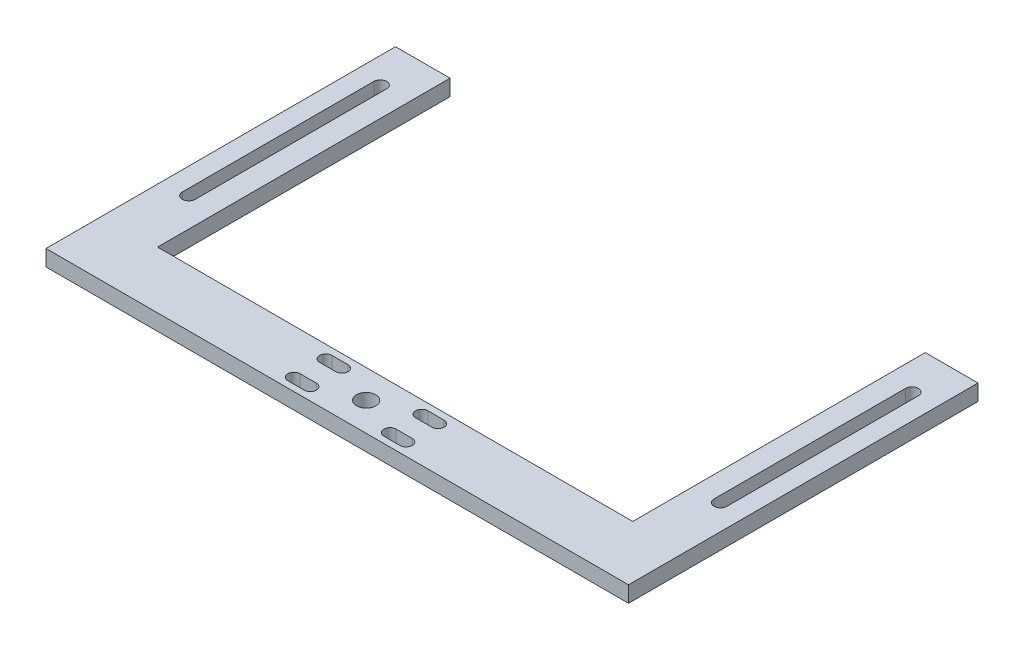
from build123d import *

# Parameters (mm, degrees)
SKETCH_5_R          = 3
EXTRUDE_4_DEPTH     = 5
CUT_EXTRUDE_2_DEPTH = 8.5
CUT_EXTRUDE_4_DEPTH = 8.5


with BuildPart() as part:
    # 草图5 → 凸台-拉伸4 (new body)
    with BuildSketch(Plane(origin=(0, 0, 0), x_dir=(1, 0, 0), z_dir=(0, 1, 0))):
        Polygon((-103.043555275, 72.404841583), (-103.043555275, -36.501510282), (78.477843527, -36.501510282), (78.477843527, 72.404841583), (62.047530944, 72.404841583), (62.047530944, -18.742135335), (-86.043555275, -18.742135335), (-86.043555275, 72.404841583), align=None)
        with BuildLine():
            Line((0.233182571, -20.809880528), (5.30281271, -20.809880528))
            ThreePointArc((5.30281271, -20.809880528), (7.20281271, -22.709880528), (5.30281271, -24.609880528))
            Line((5.30281271, -24.609880528), (0.233182571, -24.609880528))
            ThreePointArc((0.233182571, -24.609880528), (-1.666817429, -22.709880528), (0.233182571, -20.809880528))
        make_face(mode=Mode.SUBTRACT)
        with BuildLine():
            ThreePointArc((-29.666312365, -34.509375465), (-31.566312365, -32.609375465), (-29.666312365, -30.709375465))
            Line((-29.666312365, -30.709375465), (-24.596682227, -30.709375465))
            ThreePointArc((-24.596682227, -30.709375465), (-22.696682227, -32.609375465), (-24.596682227, -34.509375465))
            Line((-24.596682227, -34.509375465), (-29.666312365, -34.509375465))
        make_face(mode=Mode.SUBTRACT)
        with BuildLine():
            ThreePointArc((-29.666312365, -24.610941368), (-31.566842785, -22.710410948), (-29.666312365, -20.809880528))
            Line((-29.666312365, -20.809880528), (-24.596682227, -20.809880528))
            ThreePointArc((-24.596682227, -20.809880528), (-22.696151807, -22.710410948), (-24.596682227, -24.610941368))
            Line((-24.596682227, -24.610941368), (-29.666312365, -24.610941368))
        make_face(mode=Mode.SUBTRACT)
        with BuildLine():
            ThreePointArc((0.233182571, -34.509375465), (-1.666817429, -32.609375465), (0.233182571, -30.709375465))
            Line((0.233182571, -30.709375465), (5.30281271, -30.709375465))
            ThreePointArc((5.30281271, -30.709375465), (7.20281271, -32.609375465), (5.30281271, -34.509375465))
            Line((5.30281271, -34.509375465), (0.233182571, -34.509375465))
        make_face(mode=Mode.SUBTRACT)
        with Locations((-12.183568637, -27.595158417)):
            Circle(SKETCH_5_R, mode=Mode.SUBTRACT)
    extrude(amount=EXTRUDE_4_DEPTH)

    # 草图5<14> → 切除-拉伸2 (cut, symmetric)
    with BuildSketch(Plane(origin=(0, 0, 0), x_dir=(1, 0, 0), z_dir=(0, 1, 0))):
        with BuildLine():
            Line((-93.050173308, 59.6693943), (-93.050173308, 0))
            ThreePointArc((-93.050173308, 0), (-95.050173308, -2), (-97.050173308, 0))
            Line((-97.050173308, 0), (-97.050173308, 59.6693943))
            ThreePointArc((-97.050173308, 59.6693943), (-95.050173308, 61.6693943), (-93.050173308, 59.6693943))
        make_face()
    extrude(amount=CUT_EXTRUDE_2_DEPTH, both=True, mode=Mode.SUBTRACT)

    # 草图5<16> → 切除-拉伸4 (cut, symmetric)
    with BuildSketch(Plane(origin=(0, 0, 0), x_dir=(1, 0, 0), z_dir=(0, 1, 0))):
        with BuildLine():
            Line((72.637966918, 59.6693943), (72.637966918, 0))
            ThreePointArc((72.637966918, 0), (70.637966918, -2), (68.637966918, 0))
            Line((68.637966918, 0), (68.637966918, 59.6693943))
            ThreePointArc((68.637966918, 59.6693943), (70.637966918, 61.6693943), (72.637966918, 59.6693943))
        make_face()
    extrude(amount=CUT_EXTRUDE_4_DEPTH, both=True, mode=Mode.SUBTRACT)


solid = part.part
